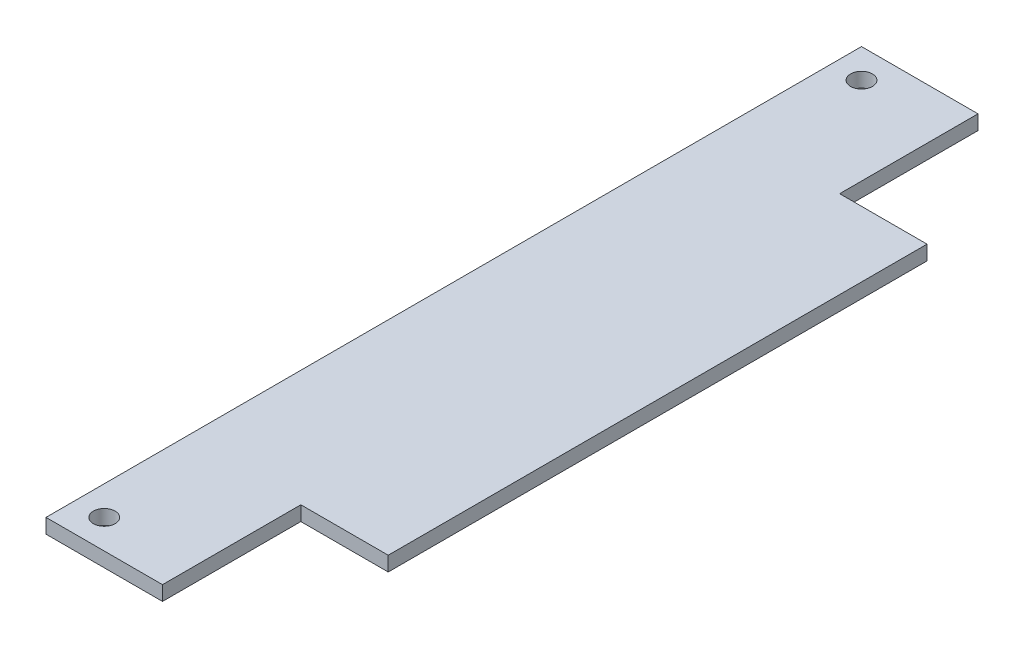
from build123d import *

# Parameters (mm, degrees)
SKETCH1_W                   = 165.1
SKETCH1_H                   = 38.1
BOSS_EXTRUDE1_DEPTH         = 3.175
F_1_4_0_25_DIAMETER_HOLE1_D = 7.9375
SKETCH4_W                   = 50.8
SKETCH4_H                   = 355.6
SKETCH4_R                   = 4.7625
BOSS_EXTRUDE2_DEPTH         = 6.35
SKETCH5_W                   = 165.1
SKETCH5_H                   = 76.2
CUT_EXTRUDE1_DEPTH          = 271.08036304
SKETCH6_W                   = 38.1
SKETCH6_H                   = 60.325
CUT_EXTRUDE2_DEPTH          = 186.023789011


with BuildPart() as part:
    # Sketch1 → Boss-Extrude1 (new, symmetric)
    with BuildSketch(Plane(origin=(0, 0, 0), x_dir=(1, 0, 0), z_dir=(0, 1, 0))):
        Polygon((0, 0), (0, -177.8), (38.1, -177.8), (38.1, -38.1), (38.1, 0), align=None)
        with Locations((120.65, -19.05)):
            Rectangle(SKETCH1_W, SKETCH1_H)
        with Locations((120.65, 19.05)):
            Rectangle(SKETCH1_W, SKETCH1_H)
        Polygon((0, 177.8), (0, 0), (38.1, 0), (38.1, 38.1), (38.1, 177.8), align=None)
    extrude(amount=BOSS_EXTRUDE1_DEPTH, both=True)

    # 1/4 (0.25) Diameter Hole1 (through all)
    with Locations(Plane(origin=(0, 3.175, 0), x_dir=(1, 0, 0), z_dir=(0, 1, 0))):
        with Locations((190.5, 25.4), (190.5, -25.4)):
            Hole(F_1_4_0_25_DIAMETER_HOLE1_D / 2)

    # Sketch4 → Boss-Extrude2 (add)
    with BuildSketch(Plane.XZ.offset(3.175)):
        with Locations((-25.4, 0)):
            Rectangle(SKETCH4_W, SKETCH4_H)
        with Locations(Location((-38.1, -165.1, 0), (0, 0, 270))):
            Circle(SKETCH4_R, mode=Mode.SUBTRACT)
        with Locations(Location((-38.1, 165.1, 0), (0, 0, 270))):
            Circle(SKETCH4_R, mode=Mode.SUBTRACT)
    extrude(amount=-BOSS_EXTRUDE2_DEPTH)

    # Sketch5 → Cut-Extrude1 (cut, through all)
    with BuildSketch(Plane.XZ.offset(3.175)):
        with Locations((120.65, 0)):
            Rectangle(SKETCH5_W, SKETCH5_H)
    extrude(amount=-CUT_EXTRUDE1_DEPTH, mode=Mode.SUBTRACT)

    # Sketch6 → Cut-Extrude2 (cut, through all)
    with BuildSketch(Plane.XZ.offset(3.175)):
        with Locations((19.05, 147.6375)):
            Rectangle(SKETCH6_W, SKETCH6_H)
        with Locations((19.05, -147.6375)):
            Rectangle(SKETCH6_W, SKETCH6_H)
    extrude(amount=-CUT_EXTRUDE2_DEPTH, mode=Mode.SUBTRACT)


solid = part.part
